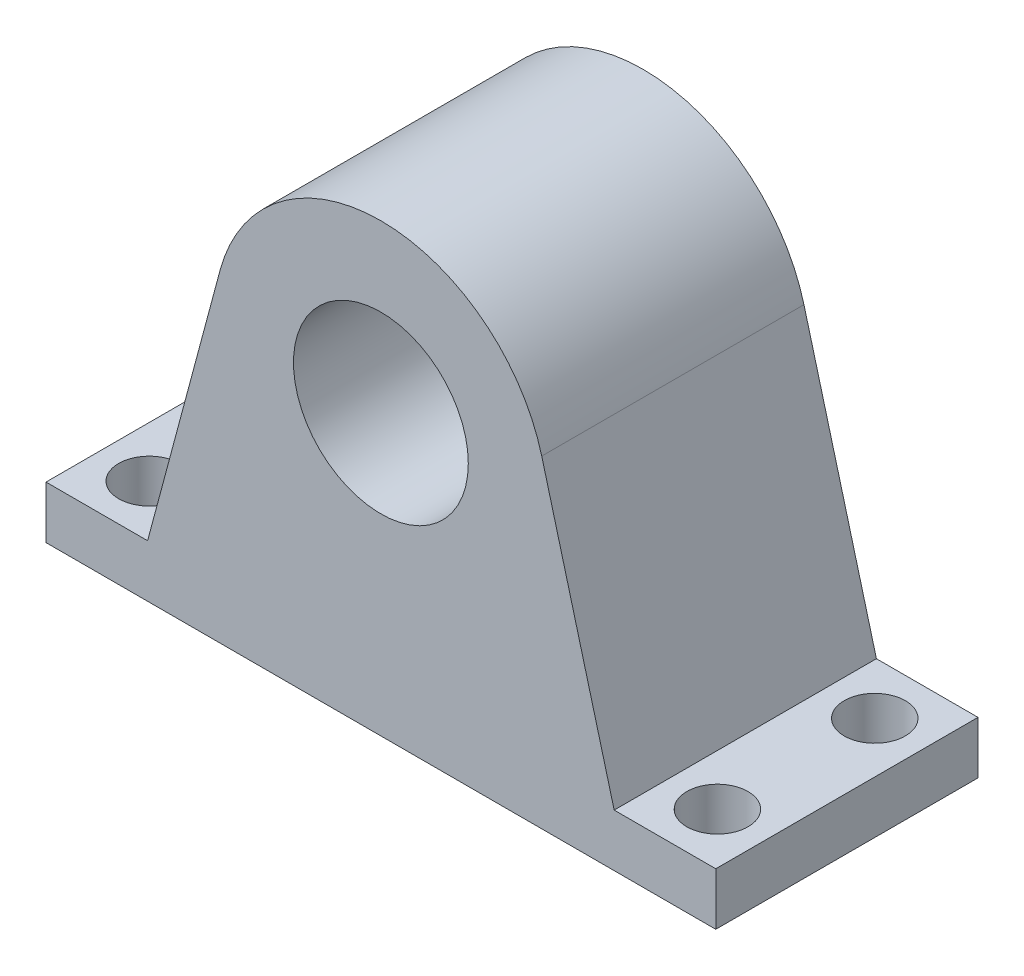
from build123d import *

# Parameters (mm, degrees)
BOSS_EXTRUDE1_DEPTH            = 30
F_20_0MM_DOWEL_HOLE1_D         = 20
F_20_0MM_DOWEL_HOLE1_DEPTH     = 74.0791
F_20_0MM_DOWEL_HOLE1_TIP       = 6.00860619
M8X1_0_TAPPED_HOLE1_AT_2_COUNT = 2
M8X1_0_TAPPED_HOLE1_AT_2_PITCH = 18


with BuildPart() as part:
    # Sketch1 → Boss-Extrude1 (new body)
    with BuildSketch(Plane.XY):
        with BuildLine():
            Line((0, 0), (-38.31130976, 0))
            Line((-38.31130976, 0), (-38.31130976, 6))
            Line((-38.31130976, 6), (-26.68869024, 6))
            Line((-26.68869024, 6), (-18.400886991, 36.930502809))
            ThreePointArc((-18.400886991, 36.930502809), (0, 51.05), (18.400886991, 36.930502809))
            Line((18.400886991, 36.930502809), (26.68869024, 6))
            Line((26.68869024, 6), (38.31130976, 6))
            Line((38.31130976, 6), (38.31130976, 0))
            Line((38.31130976, 0), (0, 0))
        make_face()
    extrude(amount=BOSS_EXTRUDE1_DEPTH)

    # Ø20.0mm Dowel Hole1
    with Locations(Plane(origin=(0, 32, 30), x_dir=(1, 0, 0), z_dir=(0, 0, 1))):
        with Locations((0, 0)):
            Hole(F_20_0MM_DOWEL_HOLE1_D / 2, depth=F_20_0MM_DOWEL_HOLE1_DEPTH)
            with Locations((0, 0, -(F_20_0MM_DOWEL_HOLE1_DEPTH + F_20_0MM_DOWEL_HOLE1_TIP / 2))):  # 118° drill point
                Cone(0, F_20_0MM_DOWEL_HOLE1_D / 2, F_20_0MM_DOWEL_HOLE1_TIP, mode=Mode.SUBTRACT)

    # Sketch6 → M8x1.0 Tapped Hole1 (revolve, cut)
    with BuildSketch(Plane(origin=(-32.5, 6, 6), x_dir=(0, 0, 1), z_dir=(1, 0, 0))):
        Polygon((0, 0), (0, 21.103012167), (3.5, 19), (3.5, 0), align=None)
    m8x1_0_tapped_hole1 = revolve(axis=Axis((-32.5, 12.35, 6), (0, -1, 0)), mode=Mode.SUBTRACT)

    # M8x1.0 Tapped Hole1 at 2: M8x1.0 Tapped Hole1 ×2
    with Locations(*[(0, 0, i * M8X1_0_TAPPED_HOLE1_AT_2_PITCH) for i in range(1, M8X1_0_TAPPED_HOLE1_AT_2_COUNT)]):
        add(m8x1_0_tapped_hole1, mode=Mode.SUBTRACT)

    # Mirror1: M8x1.0 Tapped Hole1 across plane
    add(m8x1_0_tapped_hole1.mirror(Plane(origin=(0, 0, 0), x_dir=(0, 0, 1), z_dir=(1, 0, 0))), mode=Mode.SUBTRACT)

    # Mirror1 copy 1 sketch → Mirror1 copy 1 (revolve, cut)
    with BuildSketch(Plane(origin=(32.5, 6, 24), x_dir=(0, 0, 1), z_dir=(-1, 0, 0))):
        Polygon((0, 0), (0, -21.103012167), (3.5, -19), (3.5, 0), align=None)
    revolve(axis=Axis((32.5, 12.35, 24), (0, 1, 0)), mode=Mode.SUBTRACT)


solid = part.part
